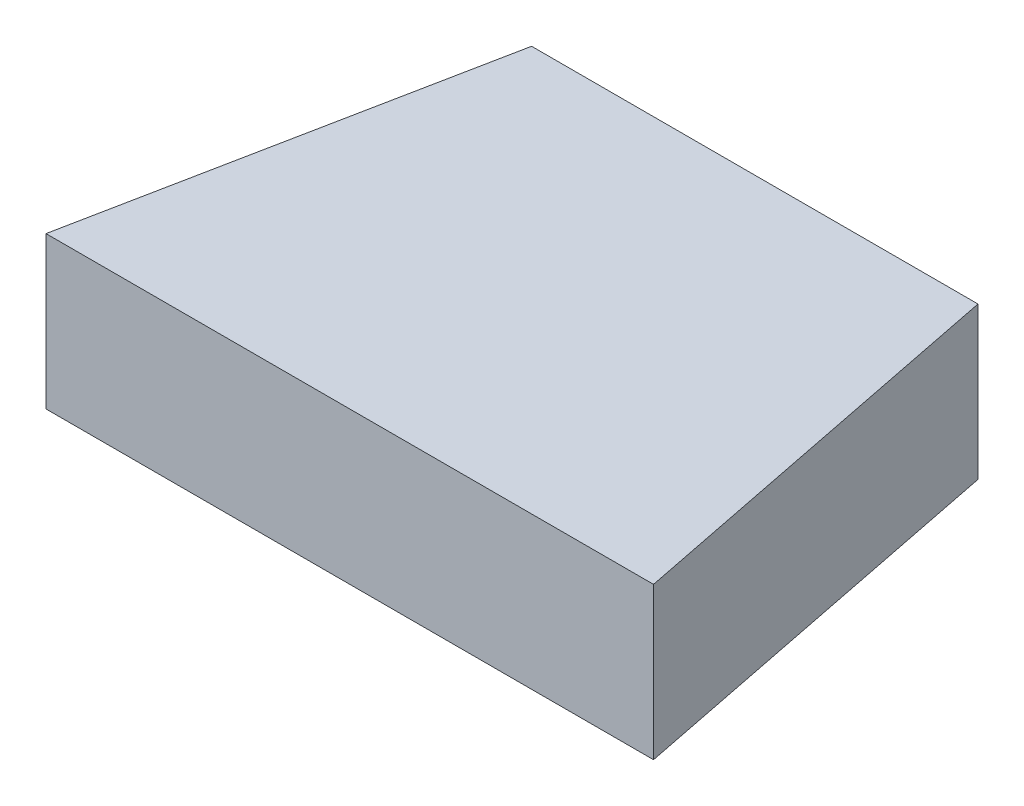
from build123d import *

# Parameters (mm, degrees)
BOSS_EXTRUDE1_DEPTH = 19.05


with BuildPart() as part:
    # Sketch1 → Boss-Extrude1 (new body)
    with BuildSketch(Plane(origin=(0, 0, 0), x_dir=(1, 0, 0), z_dir=(0, 1, 0))):
        Polygon((-38.1, -191.54163465), (38.1, -191.54163465), (27.995251737, -140.74163465), (-27.995251737, -140.74163465), align=None)
    extrude(amount=BOSS_EXTRUDE1_DEPTH)


solid = part.part
